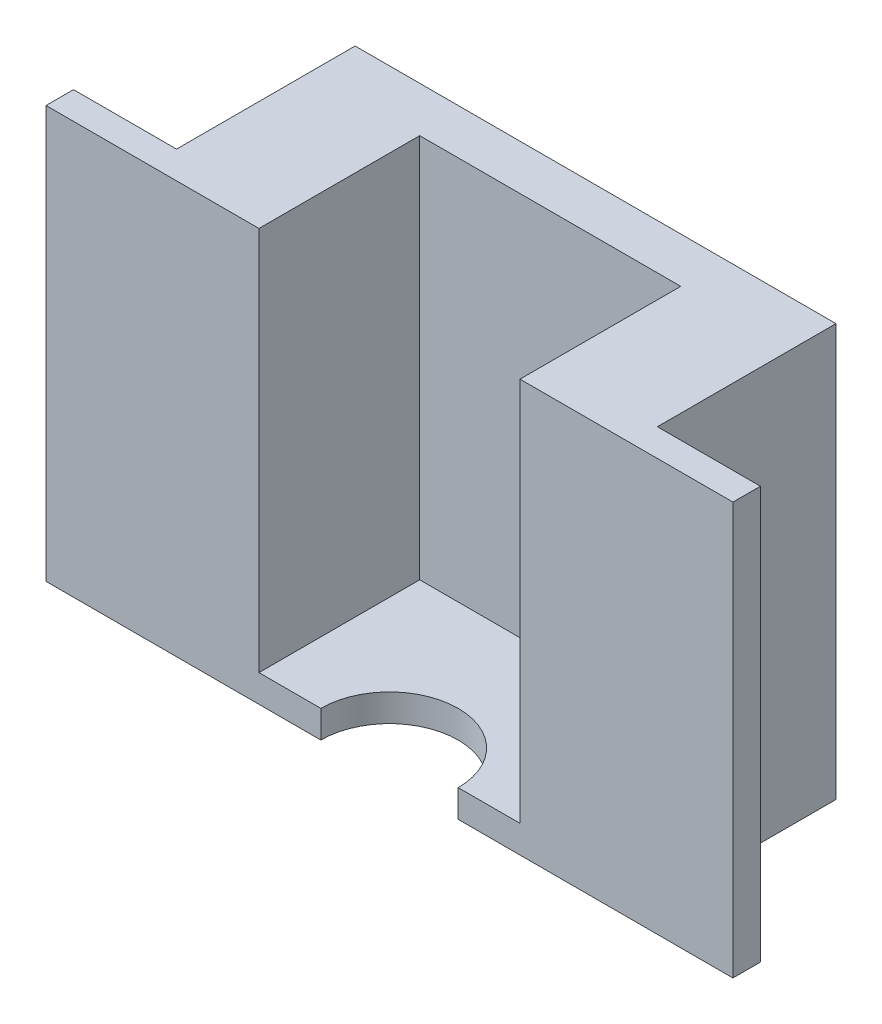
from build123d import *

# Parameters (mm, degrees)
SKETCH_1_W          = 50
SKETCH_1_H          = 30
EXTRUDE_1_DEPTH     = 15
SKETCH_2_W          = 19
SKETCH_2_H          = 11.7
CUT_EXTRUDE_1_DEPTH = 28
SKETCH_4_W          = 7.5
SKETCH_4_H          = 13
CUT_EXTRUDE_3_DEPTH = 50
SKETCH_5_W          = 7.5
SKETCH_5_H          = 13
CUT_EXTRUDE_4_DEPTH = 50
CUT_EXTRUDE_5_DEPTH = 50


with BuildPart() as part:
    # Эскиз1 → Бобышка-Вытянуть1 (new body)
    with BuildSketch(Plane.XY):
        Rectangle(SKETCH_1_W, SKETCH_1_H)
    extrude(amount=EXTRUDE_1_DEPTH)

    # Эскиз2 → Вырез-Вытянуть1 (cut)
    with BuildSketch(Plane(origin=(0, 15, 0), x_dir=(1, 0, 0), z_dir=(0, 1, 0))):
        with Locations((0, -9.15)):
            Rectangle(SKETCH_2_W, SKETCH_2_H)
    extrude(amount=-CUT_EXTRUDE_1_DEPTH, mode=Mode.SUBTRACT)

    # Эскиз4 → Вырез-Вытянуть3 (cut)
    with BuildSketch(Plane(origin=(0, 15, 0), x_dir=(1, 0, 0), z_dir=(0, 1, 0))):
        with Locations((-21.25, -6.5)):
            Rectangle(SKETCH_4_W, SKETCH_4_H)
    extrude(amount=-CUT_EXTRUDE_3_DEPTH, mode=Mode.SUBTRACT)

    # Эскиз5 → Вырез-Вытянуть4 (cut)
    with BuildSketch(Plane(origin=(0, 15, 0), x_dir=(1, 0, 0), z_dir=(0, 1, 0))):
        with Locations((21.25, -6.5)):
            Rectangle(SKETCH_5_W, SKETCH_5_H)
    extrude(amount=-CUT_EXTRUDE_4_DEPTH, mode=Mode.SUBTRACT)

    # Эскиз6 → Вырез-Вытянуть5 (cut)
    with BuildSketch(Plane.XZ.offset(15)):
        with BuildLine():
            Line((-5, 15), (5, 15))
            ThreePointArc((5, 15), (0, 10), (-5, 15))
        make_face()
    extrude(amount=-CUT_EXTRUDE_5_DEPTH, mode=Mode.SUBTRACT)


solid = part.part
